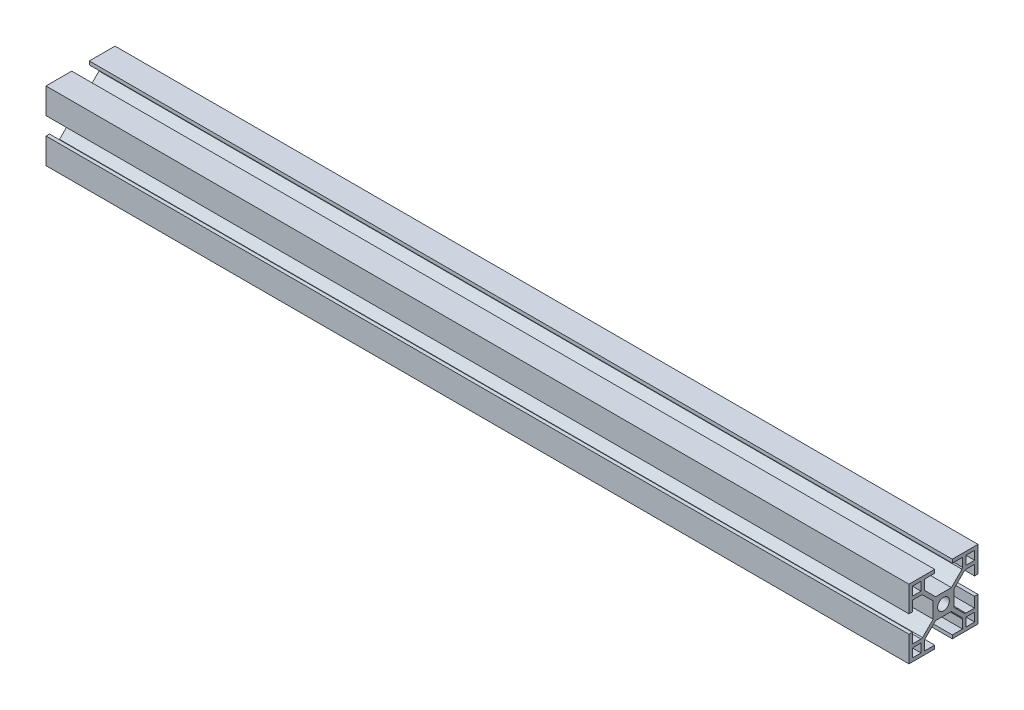
from build123d import *

# Parameters (mm, degrees)
SKETCH_1_R      = 3.4
SKETCH_1_W      = 5
SKETCH_1_H      = 5
EXTRUDE_1_DEPTH = 500


with BuildPart() as part:
    # 草图1 → 凸台-拉伸1 (new body)
    with BuildSketch(Plane(origin=(0, 0, 0), x_dir=(0, 0, -1), z_dir=(1, 0, 0))):
        Polygon((0, 6), (4.585786438, 6), (10.718811909, 12.133025471), (11, 13), (11, 18), (5.1, 18), (5.1, 20), (20, 20), (20, 5.1), (18, 5.1), (18, 11), (13, 11), (12.133025471, 10.718811909), (6, 4.585786438), (6, 0), (6, -4.585786438), (12.133025471, -10.718811909), (13, -11), (18, -11), (18, -5.1), (20, -5.1), (20, -20), (5.1, -20), (5.1, -18), (11, -18), (11, -13), (10.718811909, -12.133025471), (4.585786438, -6), (0, -6), (-4.585786438, -6), (-10.718811909, -12.133025471), (-11, -13), (-11, -18), (-5.1, -18), (-5.1, -20), (-20, -20), (-20, -5.1), (-18, -5.1), (-18, -11), (-13, -11), (-12.133025471, -10.718811909), (-6, -4.585786438), (-6, 0), (-6, 4.585786438), (-12.133025471, 10.718811909), (-13, 11), (-18, 11), (-18, 5.1), (-20, 5.1), (-20, 20), (-5.1, 20), (-5.1, 18), (-11, 18), (-11, 13), (-10.718811909, 12.133025471), (-4.585786438, 6), align=None)
        Circle(SKETCH_1_R, mode=Mode.SUBTRACT)
        with Locations((15.5, -15.5)):
            Rectangle(SKETCH_1_W, SKETCH_1_H, mode=Mode.SUBTRACT)
        with Locations((15.5, 15.5)):
            Rectangle(SKETCH_1_W, SKETCH_1_H, mode=Mode.SUBTRACT)
        with Locations((-15.5, -15.5)):
            Rectangle(SKETCH_1_W, SKETCH_1_H, mode=Mode.SUBTRACT)
        with Locations((-15.5, 15.5)):
            Rectangle(SKETCH_1_W, SKETCH_1_H, mode=Mode.SUBTRACT)
    extrude(amount=EXTRUDE_1_DEPTH)


solid = part.part
